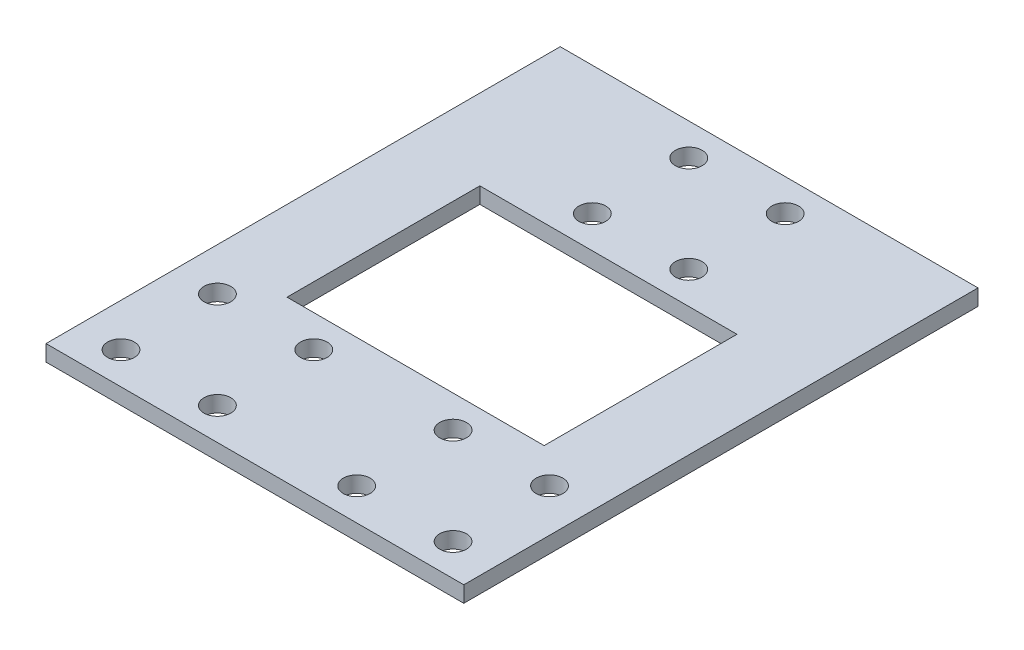
from build123d import *

# Parameters (mm, degrees)
SKETCH1_W           = 78
SKETCH1_H           = 96
BOSS_EXTRUDE1_DEPTH = 3
SKETCH2_R           = 2.5
CUT_EXTRUDE1_DEPTH  = 3
SKETCH3_W           = 48
SKETCH3_H           = 36.000458934
CUT_EXTRUDE2_DEPTH  = 3


with BuildPart() as part:
    # Sketch1 → Boss-Extrude1 (new body)
    with BuildSketch(Plane(origin=(0, 0, 0), x_dir=(1, 0, 0), z_dir=(0, 1, 0))):
        with Locations((39, 48)):
            Rectangle(SKETCH1_W, SKETCH1_H)
    extrude(amount=BOSS_EXTRUDE1_DEPTH)

    # Sketch2 → Cut-Extrude1 (cut)
    with BuildSketch(Plane(origin=(0, 3, 0), x_dir=(1, 0, 0), z_dir=(0, 1, 0))):
        with Locations(Location((8, 6, 0), (0, 0, 270))):
            Circle(SKETCH2_R)
        with Locations(Location((26, 6, 0), (0, 0, 270))):
            Circle(SKETCH2_R)
        with Locations(Location((8, 24, 0), (0, 0, 270))):
            Circle(SKETCH2_R)
        with Locations(Location((26, 24, 0), (0, 0, 270))):
            Circle(SKETCH2_R)
        with Locations(Location((52, 6, 0), (0, 0, 270))):
            Circle(SKETCH2_R)
        with Locations(Location((70, 6, 0), (0, 0, 270))):
            Circle(SKETCH2_R)
        with Locations(Location((70, 24, 0), (0, 0, 270))):
            Circle(SKETCH2_R)
        with Locations(Location((52, 24, 0), (0, 0, 270))):
            Circle(SKETCH2_R)
        with Locations(Location((48.001269273, 72.000000045, 0), (0, 0, 270))):
            Circle(SKETCH2_R)
        with Locations(Location((30.001269279, 72.000458934, 0), (0, 0, 270))):
            Circle(SKETCH2_R)
        with Locations(Location((48, 90, 0), (0, 0, 270))):
            Circle(SKETCH2_R)
        with Locations(Location((30.000000006, 90.000458889, 0), (0, 0, 270))):
            Circle(SKETCH2_R)
    extrude(amount=-CUT_EXTRUDE1_DEPTH, mode=Mode.SUBTRACT)

    # Sketch3 → Cut-Extrude2 (cut)
    with BuildSketch(Plane(origin=(0, 3, 0), x_dir=(1, 0, 0), z_dir=(0, 1, 0))):
        with Locations((39, 48.000229467)):
            Rectangle(SKETCH3_W, SKETCH3_H)
    extrude(amount=-CUT_EXTRUDE2_DEPTH, mode=Mode.SUBTRACT)


solid = part.part
